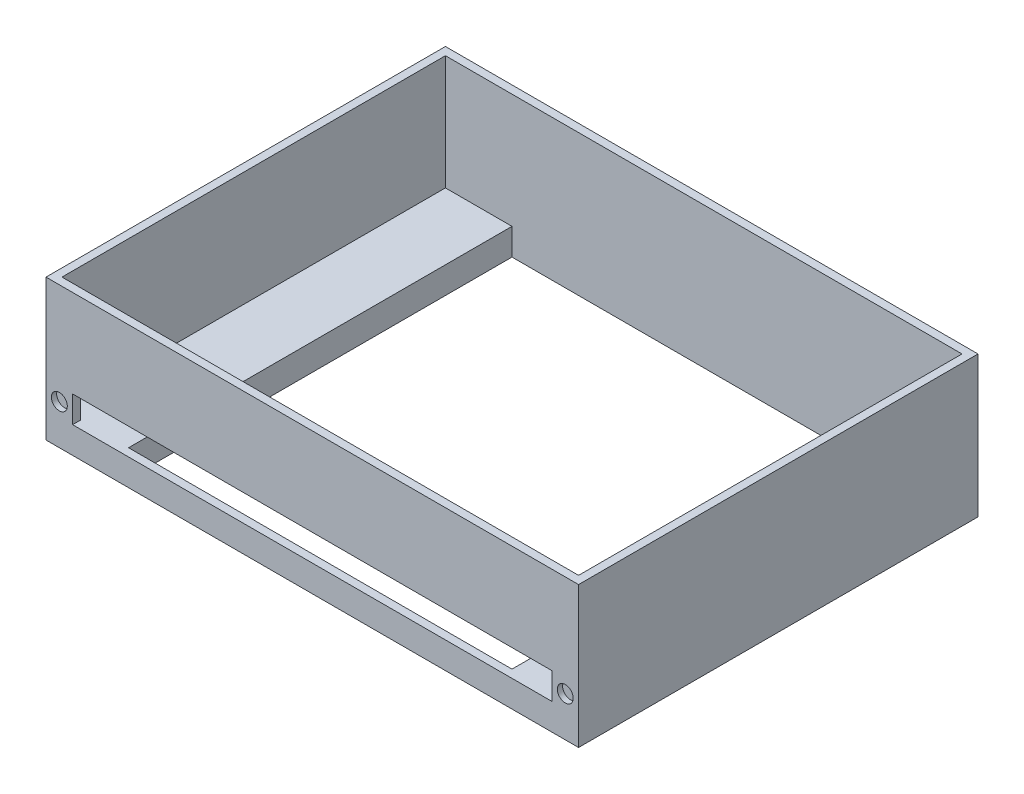
from build123d import *

# Parameters (mm, degrees)
SKETCH2_W           = 200
SKETCH2_H           = 150
BOSS_EXTRUDE1_DEPTH = 3
SKETCH3_W           = 200
SKETCH3_H           = 150
SKETCH3_W_2         = 194
SKETCH3_H_2         = 144
BOSS_EXTRUDE2_DEPTH = 50
SKETCH4_W           = 180
SKETCH4_H           = 10
CUT_EXTRUDE3_DEPTH  = 147
SKETCH5_W           = 144
SKETCH5_H           = 7
BOSS_EXTRUDE3_DEPTH = 25
SKETCH6_W           = 144
SKETCH6_H           = 7
BOSS_EXTRUDE4_DEPTH = 25
SKETCH7_W           = 144
SKETCH7_H           = 144
CUT_EXTRUDE5_DEPTH  = 135.629120178
SKETCH8_R           = 3
CUT_EXTRUDE6_DEPTH  = 2
SKETCH9_R           = 1.5
CUT_EXTRUDE7_DEPTH  = 8


with BuildPart() as part:
    # Sketch2 → Boss-Extrude1 (new body)
    with BuildSketch(Plane(origin=(0, 0, 0), x_dir=(1, 0, 0), z_dir=(0, 1, 0))):
        Rectangle(SKETCH2_W, SKETCH2_H)
    extrude(amount=BOSS_EXTRUDE1_DEPTH)

    # Sketch3 → Boss-Extrude2 (add)
    with BuildSketch(Plane(origin=(0, 3, 0), x_dir=(1, 0, 0), z_dir=(0, 1, 0))):
        Rectangle(SKETCH3_W, SKETCH3_H)
        Rectangle(SKETCH3_W_2, SKETCH3_H_2, mode=Mode.SUBTRACT)
    extrude(amount=BOSS_EXTRUDE2_DEPTH)

    # Sketch4 → Cut-Extrude3 (cut)
    with BuildSketch(Plane.XY.offset(75)):
        with Locations((0, 15)):
            Rectangle(SKETCH4_W, SKETCH4_H)
    extrude(amount=-CUT_EXTRUDE3_DEPTH, mode=Mode.SUBTRACT)

    # Sketch5 → Boss-Extrude3 (add)
    with BuildSketch(Plane.ZY.offset(-97)):
        with Locations((0, 6.5)):
            Rectangle(SKETCH5_W, SKETCH5_H)
    extrude(amount=BOSS_EXTRUDE3_DEPTH)

    # Sketch6 → Boss-Extrude4 (add)
    with BuildSketch(Plane(origin=(-97, 0, 0), x_dir=(0, 0, -1), z_dir=(1, 0, 0))):
        with Locations((0, 6.5)):
            Rectangle(SKETCH6_W, SKETCH6_H)
    extrude(amount=BOSS_EXTRUDE4_DEPTH)

    # Sketch7 → Cut-Extrude5 (cut, through all)
    with BuildSketch(Plane(origin=(0, 3, 0), x_dir=(1, 0, 0), z_dir=(0, 1, 0))):
        Rectangle(SKETCH7_W, SKETCH7_H)
    extrude(amount=-CUT_EXTRUDE5_DEPTH, mode=Mode.SUBTRACT)

    # Sketch8 → Cut-Extrude6 (cut)
    with BuildSketch(Plane.XY.offset(75)):
        with Locations((-95, 15)):
            Circle(SKETCH8_R)
        with Locations((95, 15)):
            Circle(SKETCH8_R)
    extrude(amount=-CUT_EXTRUDE6_DEPTH, mode=Mode.SUBTRACT)

    # Sketch9 → Cut-Extrude7 (cut)
    with BuildSketch(Plane.XZ):
        with Locations(Location((-95, 70, 0), (0, 0, 270))):
            Circle(SKETCH9_R)
        with Locations(Location((95, 70, 0), (0, 0, 270))):
            Circle(SKETCH9_R)
        with Locations(Location((95, -70, 0), (0, 0, 270))):
            Circle(SKETCH9_R)
        with Locations(Location((-95, -70, 0), (0, 0, 270))):
            Circle(SKETCH9_R)
    extrude(amount=-CUT_EXTRUDE7_DEPTH, mode=Mode.SUBTRACT)


solid = part.part
